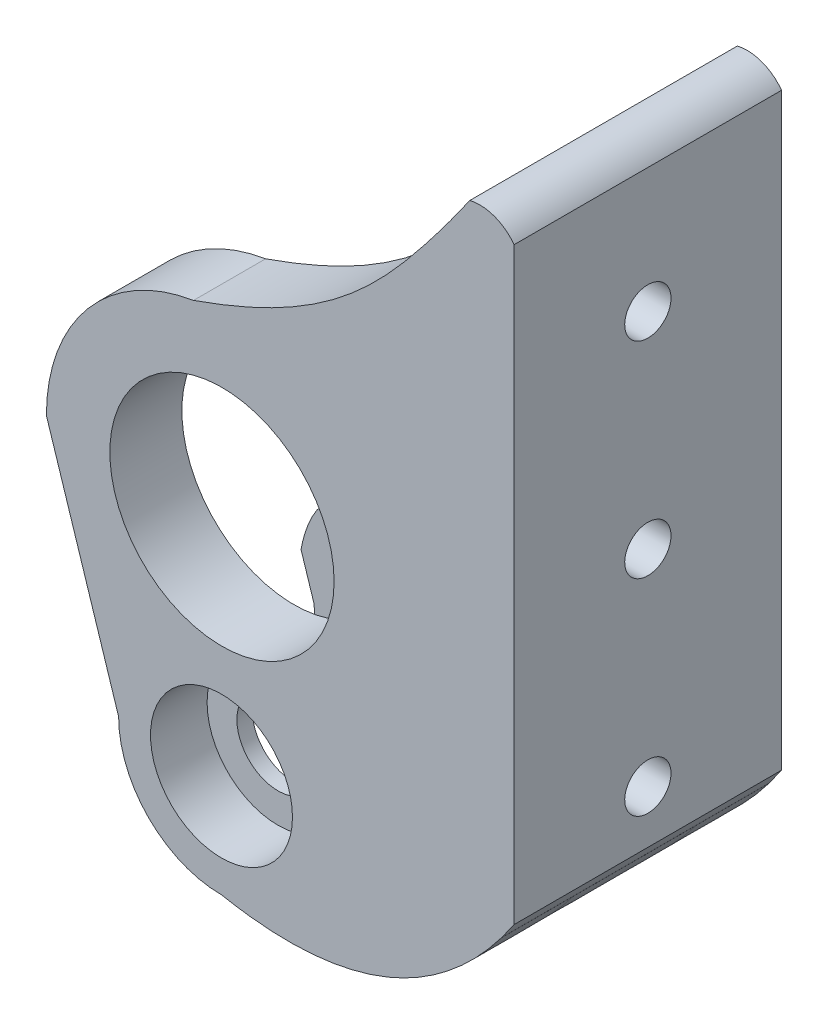
from build123d import *

# Parameters (mm, degrees)
SKETCH1_R           = 6.9
SKETCH1_R_2         = 10.9
BOSS_EXTRUDE1_DEPTH = 7
BOSS_EXTRUDE2_DEPTH = 12
CUT_EXTRUDE1_DEPTH  = 13
BOSS_EXTRUDE3_DEPTH = 26
SKETCH5_R           = 7.973914392
SKETCH5_R_2         = 4
BOSS_EXTRUDE4_DEPTH = 1.5
BOSS_EXTRUDE5_START = -1.5
SKETCH6_R           = 8.491099949
SKETCH6_R_2         = 4
BOSS_EXTRUDE5_DEPTH = 1.5
SKETCH7_R           = 2.25
CUT_EXTRUDE2_DEPTH  = 99.438905233
SCALE1_SCALE        = 1.5


with BuildPart() as part:
    # Sketch1 → Boss-Extrude1 (new body)
    with BuildSketch(Plane.XY):
        with BuildLine():
            ThreePointArc((-109.99286225, 64.498694041), (-120.238224228, 58.705152002), (-124.296770504, 47.657040238))
            Line((-124.296770504, 47.657040238), (-117.277493754, 25.812066819))
            ThreePointArc((-117.277493754, 25.812066819), (-114.348561566, 18.740999007), (-107.277493754, 15.812066819))
            add(Edge.make_bspline(
                [(-80.055270229, 25.812066819), (-90.16574855, 12.494826539), (-107.277493754, 15.812066819)],
                knots=[0, 0, 0, 1, 1, 1], degree=2))
            Line((-80.055270229, 25.812066819), (-80.055270229, 84.34418562))
            ThreePointArc((-80.055270229, 84.34418562), (-81.43033647, 86.24404293), (-83.664728026, 85.531470589))
            add(Edge.make_bspline(
                [(-109.99286225, 64.498694041), (-95.736844246, 69.471166394), (-91.130917767, 75.410465429), (-83.664728026, 85.531470589)],
                knots=[0, 0, 0, 0, 0.858728352, 0.858728352, 0.858728352, 0.858728352], degree=3))
        make_face()
        with Locations((-107.277493754, 25.812066819)):
            Circle(SKETCH1_R, mode=Mode.SUBTRACT)
        with Locations((-107.22999807, 47.657040238)):
            Circle(SKETCH1_R_2, mode=Mode.SUBTRACT)
    boss_extrude1 = extrude(amount=BOSS_EXTRUDE1_DEPTH)

    # Sketch2 → Boss-Extrude2 (add)
    with BuildSketch(Plane.XY.offset(7)):
        with BuildLine():
            Line((-85.055270217, 83.653678118), (-85.055270217, 20.583275514))
            add(Edge.make_bspline(
                [(-85.055270217, 20.583275514), (-82.371539661, 22.76114127), (-80.055270217, 25.812066834)],
                knots=[0, 0, 0, 1, 1, 1], degree=2))
            Line((-80.055270217, 25.812066834), (-80.055270229, 84.34418562))
            ThreePointArc((-80.055270229, 84.34418562), (-81.43033647, 86.24404293), (-83.664728026, 85.531470589))
            add(Edge.make_bspline(
                [(-83.664728026, 85.531470589), (-84.138702239, 84.888961408), (-84.601149423, 84.263304749), (-85.055270217, 83.653678118)],
                knots=[0, 0, 0, 0, 0.054514432, 0.054514432, 0.054514432, 0.054514432], degree=3))
        make_face()
    extrude(amount=BOSS_EXTRUDE2_DEPTH)

    # Mirror1: Boss-Extrude1 across plane
    add(boss_extrude1.mirror(Plane.XY.offset(13)))

    # Sketch3 → Cut-Extrude1 (cut)
    with BuildSketch(Plane(origin=(0, 0, 0), x_dir=(-1, 0, 0), z_dir=(0, 0, -1))):
        with BuildLine():
            Line((92.850529653, 74.397721592), (144.531216933, 88.865819457))
            Line((144.531216933, 88.865819457), (118.546118501, 29.760204905))
            add(Edge.make_bspline(
                [(107.22999807, 36.757040238), (116.864311021, 38.600442381), (118.546118501, 29.760204905)],
                knots=[0, 0, 0, 1, 1, 1], degree=2))
            ThreePointArc((107.22999807, 36.757040238), (99.522534155, 39.949576323), (96.32999807, 47.657040238))
            add(Edge.make_bspline(
                [(92.850529653, 74.397721592), (90.423550402, 60.160750292), (96.32999807, 47.657040238)],
                knots=[0, 0, 0, 1, 1, 1], degree=2))
        make_face()
    extrude(amount=-CUT_EXTRUDE1_DEPTH, mode=Mode.SUBTRACT)

    # Sketch4 → Boss-Extrude3 (add)
    with BuildSketch(Plane(origin=(0, 0, 0), x_dir=(-1, 0, 0), z_dir=(0, 0, -1))):
        with BuildLine():
            Line((83.132797407, 86.34418562), (85.055270217, 83.653678118))
            Line((85.055270217, 83.653678118), (85.055270214, 20.587782524))
            add(Edge.make_bspline(
                [(78.82999807, 27.533016311), (81.645897876, 23.355716893), (85.055270214, 20.587782524)],
                knots=[0, 0, 0, 1, 1, 1], degree=2))
            Line((78.82999807, 27.533016311), (78.82999807, 84.770259389))
            ThreePointArc((78.82999807, 84.770259389), (80.746261593, 86.200037671), (83.132797407, 86.34418562))
        make_face()
    extrude(amount=-BOSS_EXTRUDE3_DEPTH)

    # Sketch5 → Boss-Extrude4 (add)
    with BuildSketch(Plane.XY.offset(7)):
        with Locations((-107.277493754, 25.812066819)):
            Circle(SKETCH5_R)
        with Locations((-107.277493754, 25.812066819)):
            Circle(SKETCH5_R_2, mode=Mode.SUBTRACT)
    extrude(amount=-BOSS_EXTRUDE4_DEPTH)

    # Sketch6 → Boss-Extrude5 (add)
    with BuildSketch(Plane(origin=(0, 0, 19), x_dir=(-1, 0, 0), z_dir=(0, 0, -1)).offset(BOSS_EXTRUDE5_START)):
        with Locations((107.277493754, 25.812066819)):
            Circle(SKETCH6_R)
        with Locations(Location((107.277493754, 25.812066819, 0), (0, 0, 180))):
            Circle(SKETCH6_R_2, mode=Mode.SUBTRACT)
    extrude(amount=BOSS_EXTRUDE5_DEPTH)

    # Sketch7 → Cut-Extrude2 (cut, through all)
    with BuildSketch(Plane.ZY.offset(85.055270217)):
        with Locations(Location((13, 32.653678118, 0), (0, 0, 270))):
            Circle(SKETCH7_R)
        with Locations(Location((13, 52.653678118, 0), (0, 0, 270))):
            Circle(SKETCH7_R)
        with Locations(Location((13, 72.653678118, 0), (0, 0, 270))):
            Circle(SKETCH7_R)
    extrude(amount=-CUT_EXTRUDE2_DEPTH, mode=Mode.SUBTRACT)


with BuildPart() as part_1:
    # Scale1: scaled about (-91.847810328, 47.075825155, 14.137877649)
    add(part.part.scale(SCALE1_SCALE).moved(Location((45.923905164, -23.537912577, -7.068938824))))


solid = part_1.part
